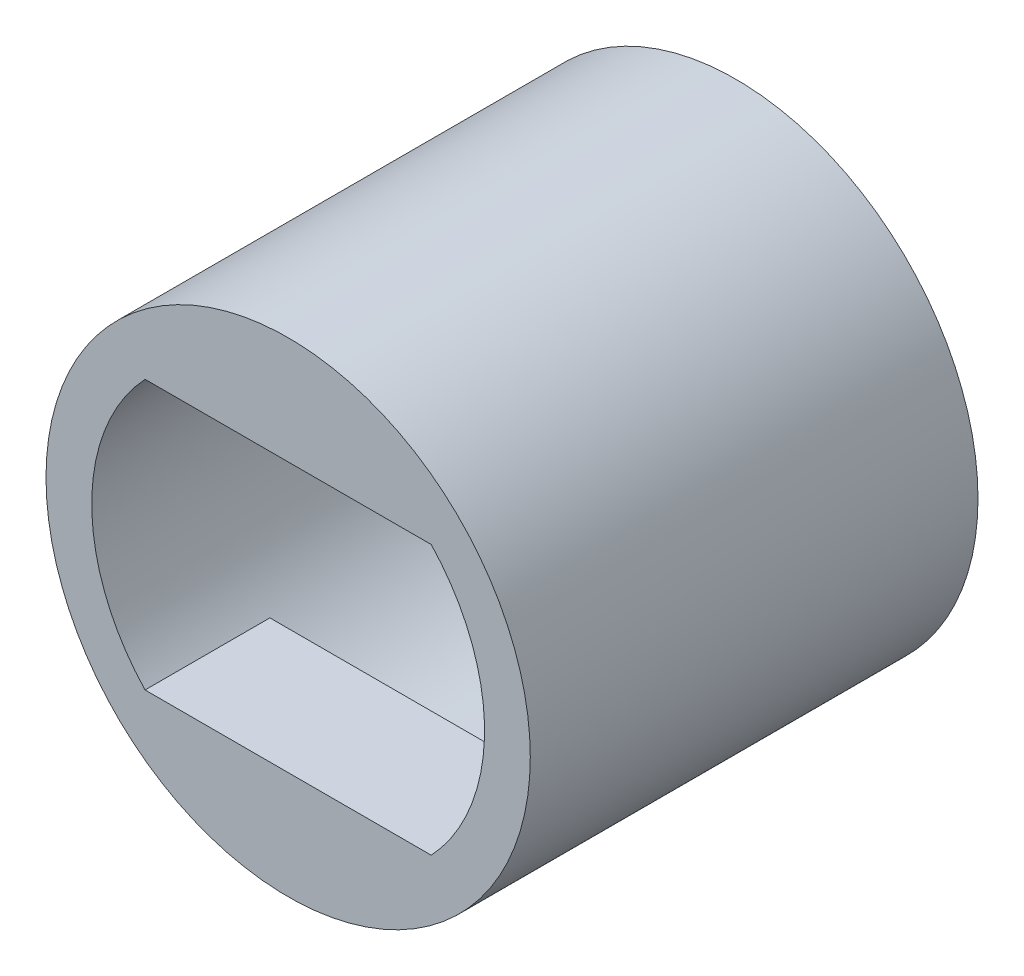
from build123d import *

# Parameters (mm, degrees)
CROQUIS1_R              = 22.5
CROQUIS1_R_2            = 18.25
SALIENTE_EXTRUIR1_DEPTH = 30
SALIENTE_EXTRUIR2_DEPTH = 11.6
SALIENTE_EXTRUIR3_DEPTH = 11.6


with BuildPart() as part:
    # Croquis1 → Saliente-Extruir1 (new body)
    with BuildSketch(Plane.XY):
        Circle(CROQUIS1_R)
        Circle(CROQUIS1_R_2, mode=Mode.SUBTRACT)
    extrude(amount=SALIENTE_EXTRUIR1_DEPTH)

    # Croquis2 → Saliente-Extruir2 (add)
    with BuildSketch(Plane.XY.offset(30)):
        with BuildLine():
            Line((-18.708286934, 12.5), (18.708286934, 12.5))
            ThreePointArc((18.708286934, 12.5), (0, 22.5), (-18.708286934, 12.5))
        make_face()
        with BuildLine():
            Line((-18.708286934, -12.5), (18.708286934, -12.5))
            ThreePointArc((18.708286934, -12.5), (0, -22.5), (-18.708286934, -12.5))
        make_face()
    extrude(amount=SALIENTE_EXTRUIR2_DEPTH)

    # Croquis3 → Saliente-Extruir3 (add)
    with BuildSketch(Plane.XY.offset(30)):
        with BuildLine():
            Line((18.708286934, 12.5), (13.297086147, 12.5))
            ThreePointArc((13.297086147, 12.5), (18.25, 0), (13.297086147, -12.5))
            Line((13.297086147, -12.5), (18.708286934, -12.5))
            ThreePointArc((18.708286934, -12.5), (22.5, 0), (18.708286934, 12.5))
        make_face()
        with BuildLine():
            Line((-13.297086147, 12.5), (-18.708286934, 12.5))
            ThreePointArc((-18.708286934, 12.5), (-22.5, 0), (-18.708286934, -12.5))
            Line((-18.708286934, -12.5), (-13.297086147, -12.5))
            ThreePointArc((-13.297086147, -12.5), (-18.25, 0), (-13.297086147, 12.5))
        make_face()
    extrude(amount=SALIENTE_EXTRUIR3_DEPTH)


solid = part.part
